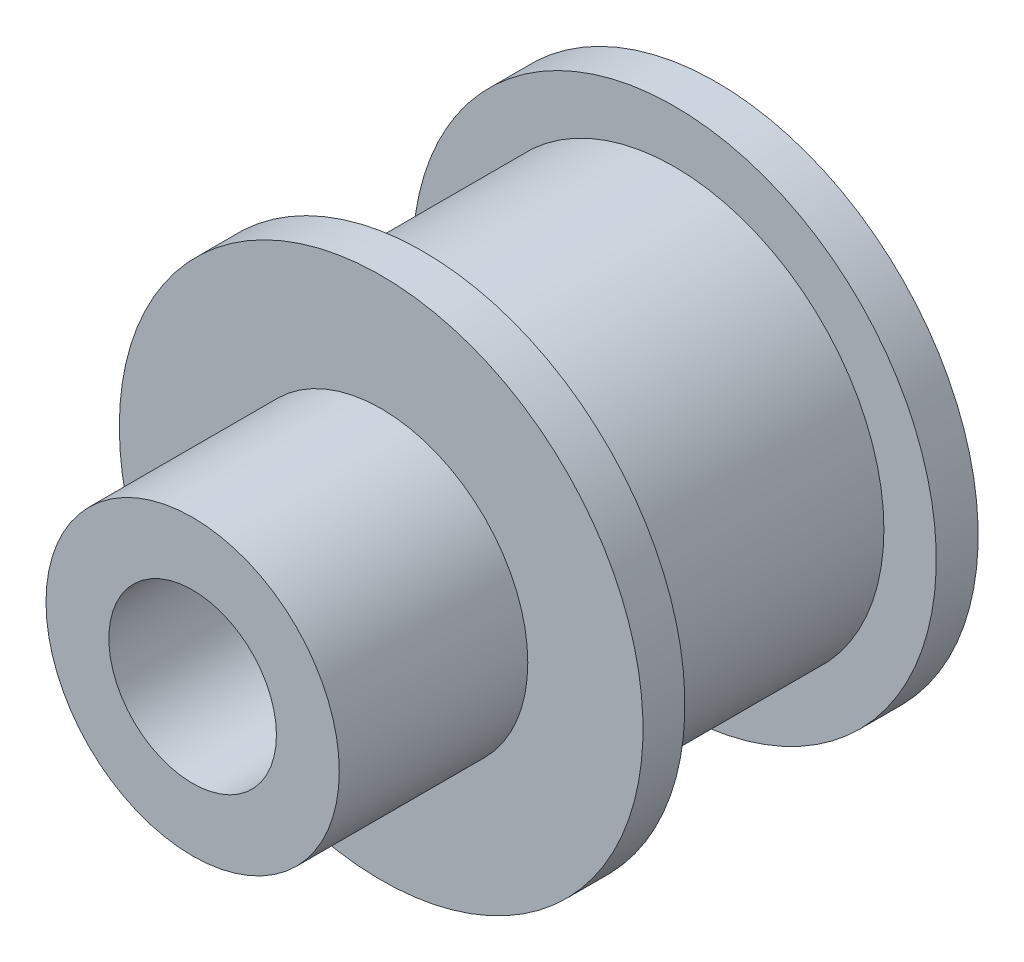
from build123d import *
from build123d.topology import SkipClean

# Parameters (mm, degrees)
SKETCH_1_R          = 7
SKETCH_1_R_2        = 4
EXTRUDE_1_DEPTH     = 9
EXTRUDE_START       = 2
SKETCH_2_R          = 12.5
SKETCH_2_R_2        = 4
EXTRUDE_2_DEPTH     = 2
SKETCH_3_R          = 10
EXTRUDE_3_DEPTH     = 12
SKETCH_4_R          = 12.5
EXTRUDE_4_DEPTH     = 2
SKETCH_5_R          = 4
CUT_EXTRUDE_1_DEPTH = 31.618621785


with BuildPart() as part:
    # 草图1 → 拉伸1 (new body)
    with BuildSketch(Plane.XY):
        Circle(SKETCH_1_R)
        Circle(SKETCH_1_R_2, mode=Mode.SUBTRACT)
    extrude(amount=EXTRUDE_1_DEPTH)

    # 草图2 → 拉伸2 (add)
    with SkipClean():  # the faces are left unmerged after this step: merging them gives an invalid solid
        with BuildSketch(Plane(origin=(0, 0, 0), x_dir=(-1, 0, 0), z_dir=(0, 0, -1)).offset(EXTRUDE_START)):
            Circle(SKETCH_2_R)
            Circle(SKETCH_2_R_2, mode=Mode.SUBTRACT)
        extrude(amount=-EXTRUDE_2_DEPTH)

    # 草图3 → 拉伸3 (add)
    with SkipClean():  # the faces are left unmerged after this step: merging them gives an invalid solid
        with BuildSketch(Plane(origin=(0, 0, -2), x_dir=(-1, 0, 0), z_dir=(0, 0, -1))):
            Circle(SKETCH_3_R)
        extrude(amount=EXTRUDE_3_DEPTH)

    # 草图4 → 拉伸4 (add)
    with SkipClean():  # the faces are left unmerged after this step: merging them gives an invalid solid
        with BuildSketch(Plane(origin=(0, 0, -14), x_dir=(-1, 0, 0), z_dir=(0, 0, -1)).offset(EXTRUDE_START)):
            Circle(SKETCH_4_R)
        extrude(amount=-EXTRUDE_4_DEPTH)

    # 草图5 → 切除-拉伸1 (cut, through all)
    with SkipClean():  # the faces are left unmerged after this step: merging them gives an invalid solid
        with BuildSketch(Plane.XY.offset(9)):
            Circle(SKETCH_5_R)
        extrude(amount=-CUT_EXTRUDE_1_DEPTH, mode=Mode.SUBTRACT)


solid = part.part
